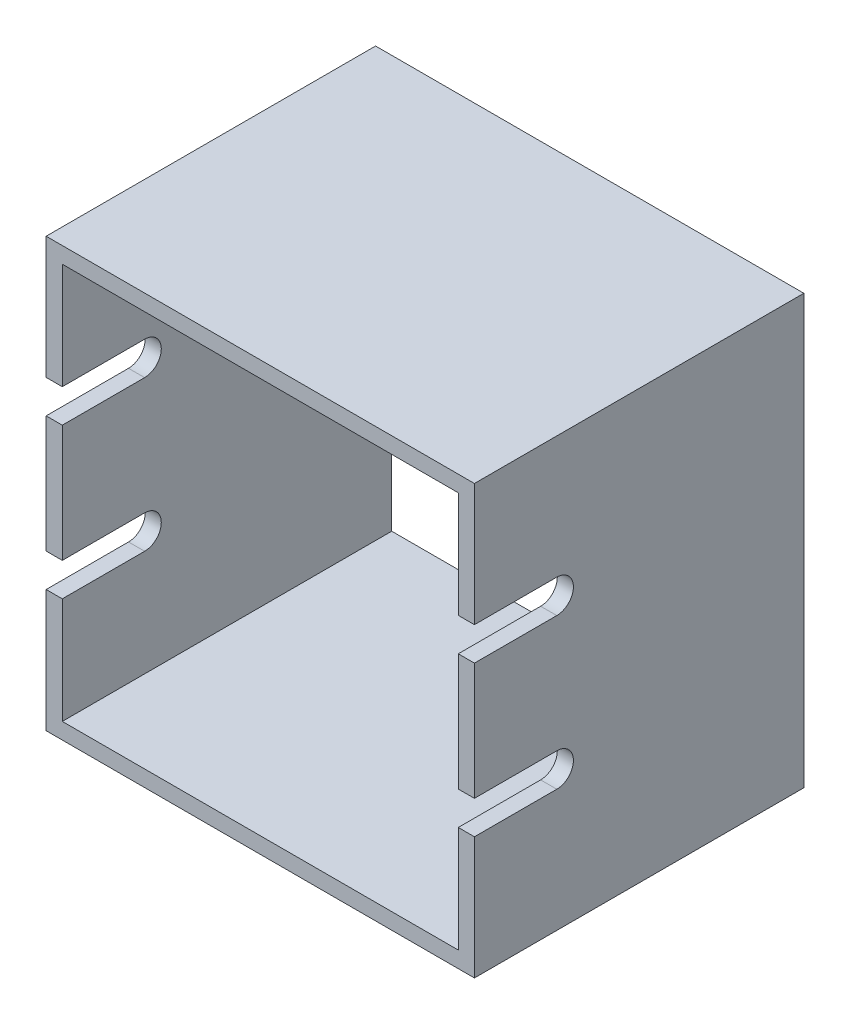
from build123d import *

# Parameters (mm, degrees)
SKETCH1_W           = 130
SKETCH1_H           = 130
BOSS_EXTRUDE1_DEPTH = 100
SKETCH2_W           = 120.2
SKETCH2_H           = 120.2
CUT_EXTRUDE1_DEPTH  = 1000
CUT_EXTRUDE2_DEPTH  = 1000


with BuildPart() as part:
    # Sketch1 → Boss-Extrude1 (new body)
    with BuildSketch(Plane(origin=(0, 0, 0), x_dir=(0, 1, 0), z_dir=(0, 0, 1))):
        Rectangle(SKETCH1_W, SKETCH1_H)
    extrude(amount=BOSS_EXTRUDE1_DEPTH)

    # Sketch2 → Cut-Extrude1 (cut)
    with BuildSketch(Plane.XY.offset(100)):
        Rectangle(SKETCH2_W, SKETCH2_H)
    extrude(amount=-CUT_EXTRUDE1_DEPTH, mode=Mode.SUBTRACT)

    # Sketch3 → Cut-Extrude2 (cut)
    with BuildSketch(Plane(origin=(-65, 0, 0), x_dir=(0, -1, 0), z_dir=(-1, 0, 0))):
        with BuildLine():
            Line((27.875, 100), (17.775, 100))
            Line((17.775, 100), (17.775, 75))
            ThreePointArc((17.775, 75), (22.825, 80.05), (27.875, 75))
            Line((27.875, 75), (27.875, 100))
        make_face()
        with BuildLine():
            Line((-17.775, 100), (-27.875, 100))
            Line((-27.875, 100), (-27.875, 75))
            ThreePointArc((-27.875, 75), (-22.825, 80.05), (-17.775, 75))
            Line((-17.775, 75), (-17.775, 100))
        make_face()
        with BuildLine():
            ThreePointArc((-17.775, 75), (-22.825, 80.05), (-27.875, 75))
            Line((-27.875, 75), (-17.775, 75))
        make_face()
        with BuildLine():
            Line((-17.775, 75), (-27.875, 75))
            ThreePointArc((-27.875, 75), (-22.825, 69.95), (-17.775, 75))
        make_face()
        with BuildLine():
            ThreePointArc((27.875, 75), (22.825, 80.05), (17.775, 75))
            Line((17.775, 75), (27.875, 75))
        make_face()
        with BuildLine():
            Line((27.875, 75), (17.775, 75))
            ThreePointArc((17.775, 75), (22.825, 69.95), (27.875, 75))
        make_face()
    extrude(amount=-CUT_EXTRUDE2_DEPTH, mode=Mode.SUBTRACT)


solid = part.part
